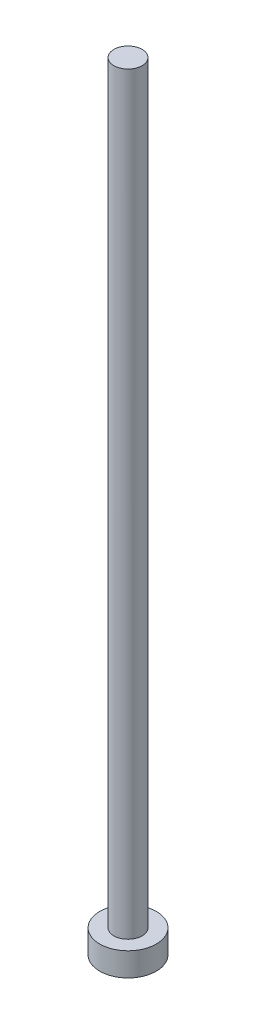
from build123d import *

# Parameters (mm, degrees)
SKETCH1_R           = 3
BOSS_EXTRUDE1_DEPTH = 160
SKETCH2_R           = 6
BOSS_EXTRUDE2_DEPTH = 5


with BuildPart() as part:
    # Sketch1 → Boss-Extrude1 (new body)
    with BuildSketch(Plane(origin=(0, 0, 0), x_dir=(1, 0, 0), z_dir=(0, 1, 0))):
        with Locations(Location((0, 0, 0), (0, 0, 270))):
            Circle(SKETCH1_R)
    extrude(amount=BOSS_EXTRUDE1_DEPTH)

    # Sketch2 → Boss-Extrude2 (add)
    with BuildSketch(Plane.XZ):
        with Locations(Location((0, 0, 0), (0, 0, 270))):
            Circle(SKETCH2_R)
    extrude(amount=BOSS_EXTRUDE2_DEPTH)


solid = part.part
